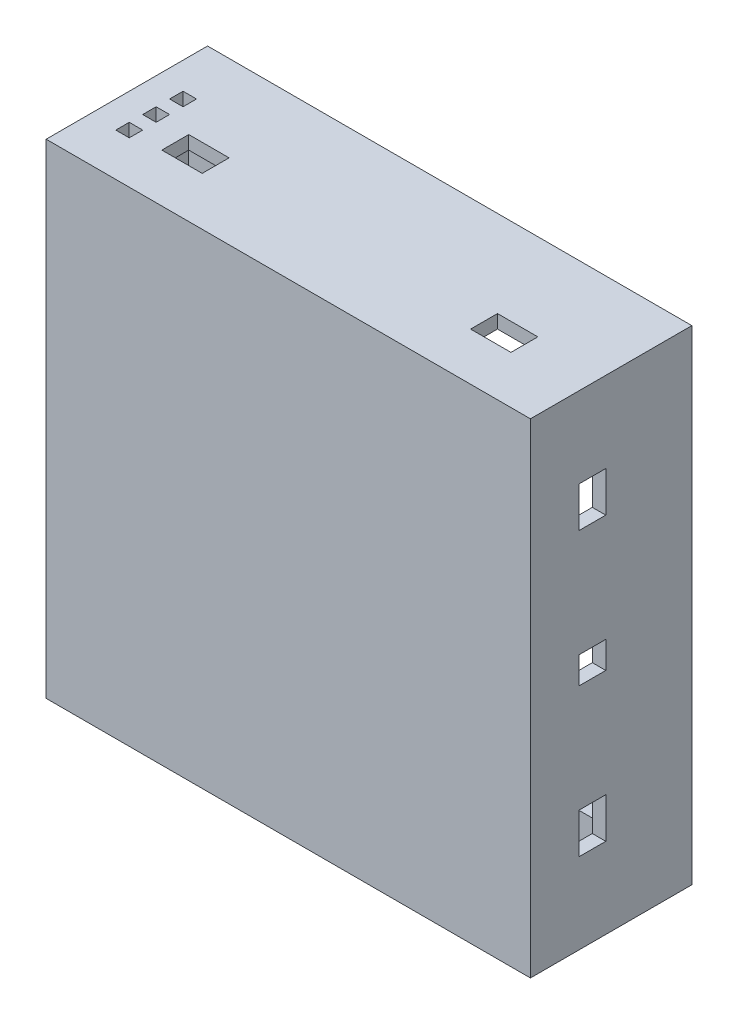
from build123d import *

# Parameters (mm, degrees)
SKETCH1_W            = 180
SKETCH1_H            = 180
BOSS_EXTRUDE1_DEPTH  = 10
SKETCH2_W            = 180
SKETCH2_H            = 180
SKETCH2_W_2          = 160
SKETCH2_H_2          = 160
BOSS_EXTRUDE2_DEPTH  = 80
SKETCH3_W            = 160
SKETCH3_H            = 20
BOSS_EXTRUDE4_DEPTH  = 20
SKETCH5_W            = 20
SKETCH5_H            = 180
CUT_EXTRUDE1_DEPTH   = 300
SKETCH6_W            = 160
SKETCH6_H            = 20
CUT_EXTRUDE2_DEPTH   = 5
SKETCH9_W            = 160
SKETCH9_H            = 15
BOSS_EXTRUDE6_DEPTH  = 10
SKETCH11_W           = 28
SKETCH11_H           = 77
CUT_EXTRUDE4_DEPTH   = 10
SKETCH13_W           = 10
SKETCH13_H           = 10
CUT_EXTRUDE5_DEPTH   = 10
SKETCH15_W           = 10
SKETCH15_H           = 180
BOSS_EXTRUDE7_DEPTH  = 30
SKETCH16_W           = 10
SKETCH16_H           = 15
CUT_EXTRUDE6_DEPTH   = 30
SKETCH17_W           = 10
SKETCH17_H           = 10
CUT_EXTRUDE7_DEPTH   = 300
SKETCH22_W           = 20.069553575
SKETCH22_H           = 29.294084881
BOSS_EXTRUDE8_DEPTH  = 10
SKETCH23_W           = 10
SKETCH23_H           = 10
CUT_EXTRUDE11_DEPTH  = 10
SKETCH24_W           = 180
SKETCH24_H           = 30
CUT_EXTRUDE12_DEPTH  = 300
SKETCH26_W           = 18
SKETCH26_H           = 77
BOSS_EXTRUDE9_DEPTH  = 10
SKETCH27_W           = 160
SKETCH27_H           = 160
CUT_EXTRUDE13_DEPTH  = 10
SKETCH28_W           = 180
SKETCH28_H           = 7.5
BOSS_EXTRUDE10_DEPTH = 180
SKETCH29_W           = 160
SKETCH29_H           = 10
BOSS_EXTRUDE11_DEPTH = 5
SKETCH34_W           = 170
SKETCH34_H           = 170
CUT_EXTRUDE14_DEPTH  = 40
SKETCH35_W           = 180
SKETCH35_H           = 180
SKETCH35_W_2         = 170
SKETCH35_H_2         = 170
BOSS_EXTRUDE13_DEPTH = 20
SKETCH36_W           = 180
SKETCH36_H           = 5
BOSS_EXTRUDE14_DEPTH = 180
SKETCH37_W           = 180
SKETCH37_H           = 180
SKETCH37_W_2         = 170
SKETCH37_H_2         = 170
BOSS_EXTRUDE15_DEPTH = 40
SKETCH38_W           = 170
SKETCH38_H           = 15
BOSS_EXTRUDE16_DEPTH = 5
SKETCH39_W           = 10
SKETCH39_H           = 15
SKETCH39_H_2         = 10
CUT_EXTRUDE15_DEPTH  = 5
SKETCH40_W           = 15
SKETCH40_H           = 10
CUT_EXTRUDE16_DEPTH  = 300
SKETCH44_W           = 170
SKETCH44_H           = 170
SKETCH44_W_2         = 150
SKETCH44_H_2         = 150
BOSS_EXTRUDE17_DEPTH = 5
SKETCH45_W           = 5
SKETCH45_H           = 5
CUT_EXTRUDE17_DEPTH  = 5
SKETCH46_W           = 15
SKETCH46_H           = 10
CUT_EXTRUDE18_DEPTH  = 300


with BuildPart() as part:
    # Sketch1 → Boss-Extrude1 (new body)
    with BuildSketch(Plane.XY):
        with Locations((90, 90)):
            Rectangle(SKETCH1_W, SKETCH1_H)
    extrude(amount=BOSS_EXTRUDE1_DEPTH)

    # Sketch2 → Boss-Extrude2 (add)
    with BuildSketch(Plane.XY.offset(10)):
        with Locations((90, 90)):
            Rectangle(SKETCH2_W, SKETCH2_H)
        with Locations((90, 90)):
            Rectangle(SKETCH2_W_2, SKETCH2_H_2, mode=Mode.SUBTRACT)
    extrude(amount=BOSS_EXTRUDE2_DEPTH)

    # Sketch3 → Boss-Extrude4 (add)
    with BuildSketch(Plane.XY.offset(10)):
        with Locations((90, 20)):
            Rectangle(SKETCH3_W, SKETCH3_H)
        with Locations((90, 160)):
            Rectangle(SKETCH3_W, SKETCH3_H)
    extrude(amount=BOSS_EXTRUDE4_DEPTH)

    # Sketch5 → Cut-Extrude1 (cut)
    with BuildSketch(Plane(origin=(180, 0, 0), x_dir=(0, 0, -1), z_dir=(1, 0, 0))):
        with Locations((-80, 90)):
            Rectangle(SKETCH5_W, SKETCH5_H)
    extrude(amount=-CUT_EXTRUDE1_DEPTH, mode=Mode.SUBTRACT)

    # Sketch6 → Cut-Extrude2 (cut)
    with BuildSketch(Plane.XY.offset(30)):
        with Locations((90, 160)):
            Rectangle(SKETCH6_W, SKETCH6_H)
        with Locations((90, 20)):
            Rectangle(SKETCH6_W, SKETCH6_H)
    extrude(amount=-CUT_EXTRUDE2_DEPTH, mode=Mode.SUBTRACT)

    # Sketch9 → Boss-Extrude6 (add)
    with BuildSketch(Plane.XY.offset(62)):
        with Locations((90, 17.5)):
            Rectangle(SKETCH9_W, SKETCH9_H)
        with Locations((90, 162.5)):
            Rectangle(SKETCH9_W, SKETCH9_H)
    extrude(amount=-BOSS_EXTRUDE6_DEPTH)

    # Sketch11 → Cut-Extrude4 (cut)
    with BuildSketch(Plane.ZY):
        with Locations((34, 83.5)):
            Rectangle(SKETCH11_W, SKETCH11_H)
    extrude(amount=-CUT_EXTRUDE4_DEPTH, mode=Mode.SUBTRACT)

    # Sketch13 → Cut-Extrude5 (cut)
    with BuildSketch(Plane(origin=(180, 0, 0), x_dir=(0, 0, -1), z_dir=(1, 0, 0))):
        with Locations((-45.269958147, 35)):
            Rectangle(SKETCH13_W, SKETCH13_H)
        with Locations((-45.269958147, 145)):
            Rectangle(SKETCH13_W, SKETCH13_H)
        with Locations((-45.269958147, 90)):
            Rectangle(SKETCH13_W, SKETCH13_H)
    extrude(amount=-CUT_EXTRUDE5_DEPTH, mode=Mode.SUBTRACT)

    # Sketch15 → Boss-Extrude7 (add)
    with BuildSketch(Plane.XY.offset(70)):
        with Locations((175, 90)):
            Rectangle(SKETCH15_W, SKETCH15_H)
    extrude(amount=-BOSS_EXTRUDE7_DEPTH)

    # Sketch16 → Cut-Extrude6 (cut)
    with BuildSketch(Plane(origin=(180, 0, 0), x_dir=(0, 0, -1), z_dir=(1, 0, 0))):
        with Locations((-45, 37.5)):
            Rectangle(SKETCH16_W, SKETCH16_H)
        with Locations((-45, 90)):
            Rectangle(SKETCH16_W, SKETCH16_H)
        with Locations((-45, 142.5)):
            Rectangle(SKETCH16_W, SKETCH16_H)
    extrude(amount=-CUT_EXTRUDE6_DEPTH, mode=Mode.SUBTRACT)

    # Sketch17 → Cut-Extrude7 (cut)
    with BuildSketch(Plane(origin=(0, 180, 0), x_dir=(1, 0, 0), z_dir=(0, 1, 0))):
        with Locations((25, -45)):
            Rectangle(SKETCH17_W, SKETCH17_H)
        with Locations((155, -45)):
            Rectangle(SKETCH17_W, SKETCH17_H)
    extrude(amount=-CUT_EXTRUDE7_DEPTH, mode=Mode.SUBTRACT)

    # Sketch22 → Boss-Extrude8 (add)
    with BuildSketch(Plane(origin=(180, 0, 0), x_dir=(0, 0, -1), z_dir=(1, 0, 0))):
        with Locations((-44.930981983, 90.571261677)):
            Rectangle(SKETCH22_W, SKETCH22_H)
    extrude(amount=-BOSS_EXTRUDE8_DEPTH)

    # Sketch23 → Cut-Extrude11 (cut)
    with BuildSketch(Plane.XZ):
        with Locations((25, 25)):
            Rectangle(SKETCH23_W, SKETCH23_H)
    extrude(amount=-CUT_EXTRUDE11_DEPTH, mode=Mode.SUBTRACT)

    # Sketch24 → Cut-Extrude12 (cut)
    with BuildSketch(Plane(origin=(0, 180, 0), x_dir=(1, 0, 0), z_dir=(0, 1, 0))):
        with Locations((90, -15)):
            Rectangle(SKETCH24_W, SKETCH24_H)
    extrude(amount=-CUT_EXTRUDE12_DEPTH, mode=Mode.SUBTRACT)

    # Sketch26 → Boss-Extrude9 (add)
    with BuildSketch(Plane.ZY):
        with Locations((39, 83.5)):
            Rectangle(SKETCH26_W, SKETCH26_H)
    extrude(amount=-BOSS_EXTRUDE9_DEPTH)

    # Sketch27 → Cut-Extrude13 (cut)
    with BuildSketch(Plane.XY.offset(62)):
        with Locations((90, 90)):
            Rectangle(SKETCH27_W, SKETCH27_H)
    extrude(amount=-CUT_EXTRUDE13_DEPTH, mode=Mode.SUBTRACT)

    # Sketch28 → Boss-Extrude10 (add)
    with BuildSketch(Plane(origin=(0, 180, 0), x_dir=(1, 0, 0), z_dir=(0, 1, 0))):
        with Locations((90, -66.25)):
            Rectangle(SKETCH28_W, SKETCH28_H)
    extrude(amount=-BOSS_EXTRUDE10_DEPTH)

    # Sketch29 → Boss-Extrude11 (add)
    with BuildSketch(Plane(origin=(0, 0, 62.5), x_dir=(-1, 0, 0), z_dir=(0, 0, -1))):
        with Locations((-90, 165)):
            Rectangle(SKETCH29_W, SKETCH29_H)
        with Locations((-90, 15)):
            Rectangle(SKETCH29_W, SKETCH29_H)
    extrude(amount=BOSS_EXTRUDE11_DEPTH)

    # Sketch34 → Cut-Extrude14 (cut)
    with BuildSketch(Plane(origin=(0, 0, 30), x_dir=(-1, 0, 0), z_dir=(0, 0, -1))):
        with Locations((-90, 90)):
            Rectangle(SKETCH34_W, SKETCH34_H)
    extrude(amount=-CUT_EXTRUDE14_DEPTH, mode=Mode.SUBTRACT)

    # Sketch35 → Boss-Extrude13 (add)
    with BuildSketch(Plane.XY.offset(70)):
        with Locations((90, 90)):
            Rectangle(SKETCH35_W, SKETCH35_H)
        with Locations((90, 90)):
            Rectangle(SKETCH35_W_2, SKETCH35_H_2, mode=Mode.SUBTRACT)
    extrude(amount=BOSS_EXTRUDE13_DEPTH)

    # Sketch36 → Boss-Extrude14 (add)
    with BuildSketch(Plane.XZ):
        with Locations((90, 87.5)):
            Rectangle(SKETCH36_W, SKETCH36_H)
    extrude(amount=-BOSS_EXTRUDE14_DEPTH)

    # Sketch37 → Boss-Extrude15 (add)
    with BuildSketch(Plane(origin=(0, 0, 30), x_dir=(-1, 0, 0), z_dir=(0, 0, -1))):
        with Locations((-90, 90)):
            Rectangle(SKETCH37_W, SKETCH37_H)
        with Locations((-90, 90)):
            Rectangle(SKETCH37_W_2, SKETCH37_H_2, mode=Mode.SUBTRACT)
    extrude(amount=-BOSS_EXTRUDE15_DEPTH)

    # Sketch38 → Boss-Extrude16 (add)
    with BuildSketch(Plane(origin=(0, 0, 85), x_dir=(-1, 0, 0), z_dir=(0, 0, -1))):
        with Locations((-90, 167.5)):
            Rectangle(SKETCH38_W, SKETCH38_H)
        with Locations((-90, 12.5)):
            Rectangle(SKETCH38_W, SKETCH38_H)
    extrude(amount=BOSS_EXTRUDE16_DEPTH)

    # Sketch39 → Cut-Extrude15 (cut)
    with BuildSketch(Plane(origin=(180, 0, 0), x_dir=(0, 0, -1), z_dir=(1, 0, 0))):
        with Locations((-67, 142.5)):
            Rectangle(SKETCH39_W, SKETCH39_H)
        with Locations((-67, 37.5)):
            Rectangle(SKETCH39_W, SKETCH39_H)
        with Locations((-67, 90)):
            Rectangle(SKETCH39_W, SKETCH39_H_2)
    extrude(amount=-CUT_EXTRUDE15_DEPTH, mode=Mode.SUBTRACT)

    # Sketch40 → Cut-Extrude16 (cut)
    with BuildSketch(Plane(origin=(0, 180, 0), x_dir=(1, 0, 0), z_dir=(0, 1, 0))):
        with Locations((32.5, -67)):
            Rectangle(SKETCH40_W, SKETCH40_H)
    extrude(amount=-CUT_EXTRUDE16_DEPTH, mode=Mode.SUBTRACT)

    # Sketch44 → Boss-Extrude17 (add)
    with BuildSketch(Plane(origin=(0, 0, 37), x_dir=(-1, 0, 0), z_dir=(0, 0, -1))):
        with Locations((-90, 90)):
            Rectangle(SKETCH44_W, SKETCH44_H)
        with Locations((-90, 90)):
            Rectangle(SKETCH44_W_2, SKETCH44_H_2, mode=Mode.SUBTRACT)
    extrude(amount=-BOSS_EXTRUDE17_DEPTH)

    # Sketch45 → Cut-Extrude17 (cut)
    with BuildSketch(Plane(origin=(0, 180, 0), x_dir=(1, 0, 0), z_dir=(0, 1, 0))):
        with Locations((12.5, -61.614476268)):
            Rectangle(SKETCH45_W, SKETCH45_H)
        with Locations((12.5, -51.614476268)):
            Rectangle(SKETCH45_W, SKETCH45_H)
        with Locations((12.5, -71.614476268)):
            Rectangle(SKETCH45_W, SKETCH45_H)
    extrude(amount=-CUT_EXTRUDE17_DEPTH, mode=Mode.SUBTRACT)

    # Sketch46 → Cut-Extrude18 (cut)
    with BuildSketch(Plane(origin=(0, 180, 0), x_dir=(1, 0, 0), z_dir=(0, 1, 0))):
        with Locations((147.5, -67.241667744)):
            Rectangle(SKETCH46_W, SKETCH46_H)
    extrude(amount=-CUT_EXTRUDE18_DEPTH, mode=Mode.SUBTRACT)


solid = part.part
